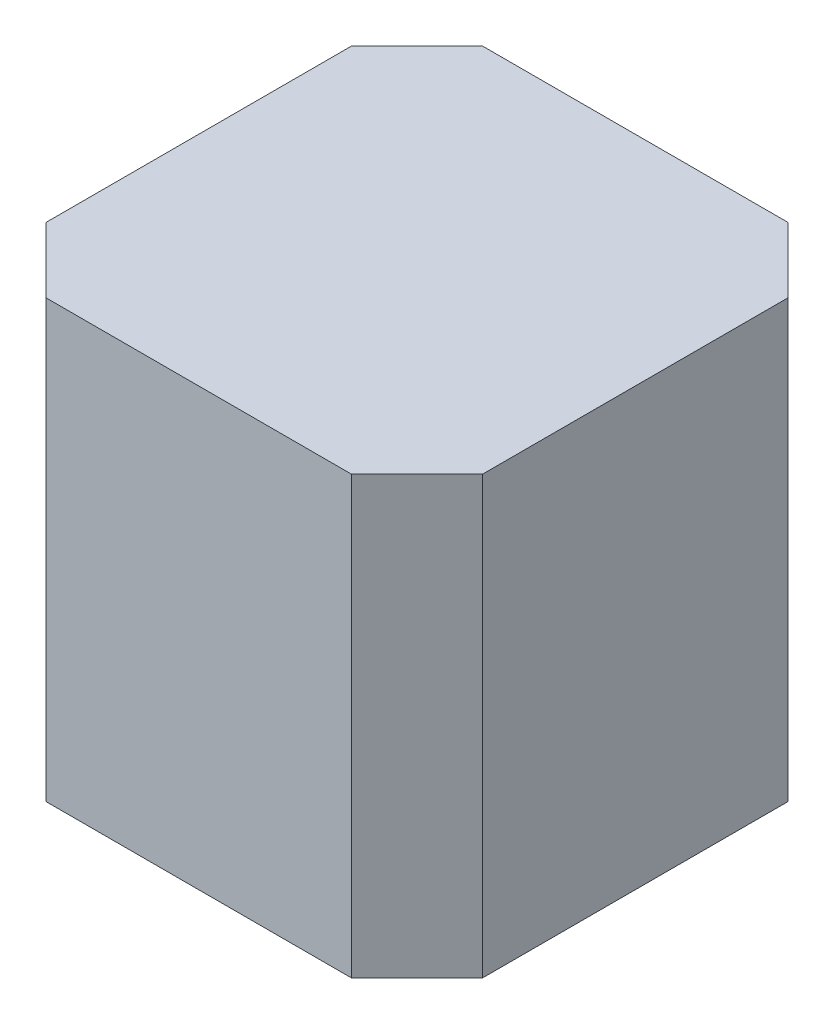
from build123d import *

# Parameters (mm, degrees)
SKETCH1_W           = 2.54
SKETCH1_H           = 2.54
BOSS_EXTRUDE1_DEPTH = 2.54
CHAMFER1_SIZE       = 0.381


with BuildPart() as part:
    # Sketch1 → Boss-Extrude1 (new body)
    with BuildSketch(Plane(origin=(0, 0, 0), x_dir=(1, 0, 0), z_dir=(0, 1, 0))):
        Rectangle(SKETCH1_W, SKETCH1_H)
    extrude(amount=BOSS_EXTRUDE1_DEPTH)

    # Chamfer1
    chamfer1_edges = [part.edges().sort_by_distance(p)[0] for p in [
        (-1.27, 1.27, -1.27),
        (1.27, 1.27, -1.27),
        (1.27, 1.27, 1.27),
        (-1.27, 1.27, 1.27),
    ]]
    chamfer(chamfer1_edges, length=CHAMFER1_SIZE)


solid = part.part
